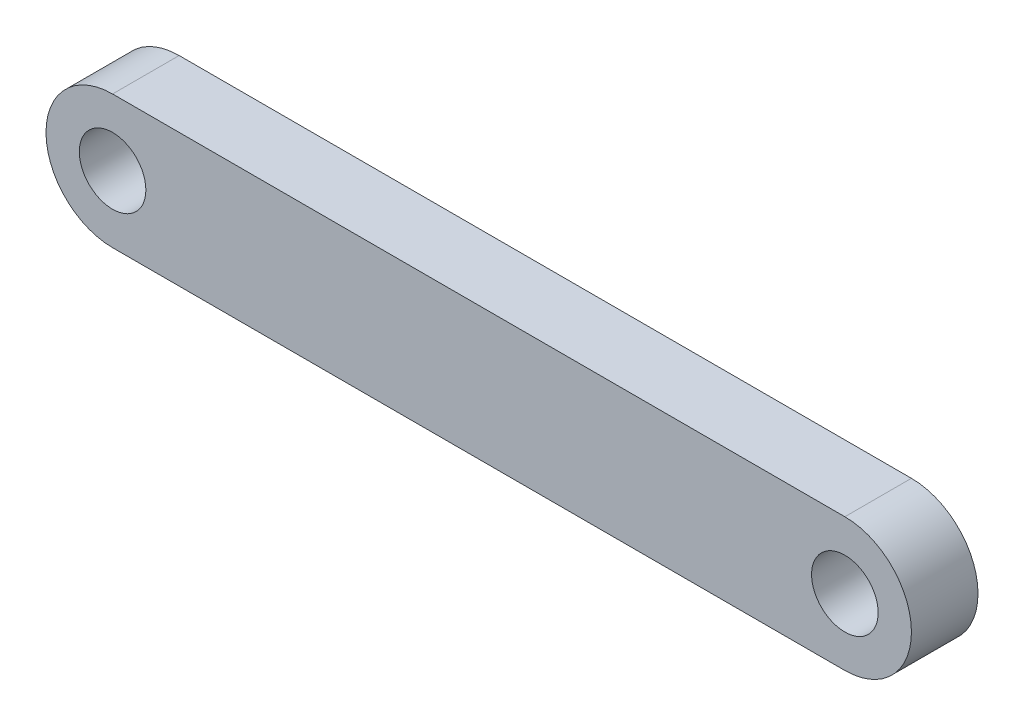
from build123d import *

# Parameters (mm, degrees)
SKETCH_1_R      = 1.5
EXTRUDE_1_DEPTH = 3


with BuildPart() as part:
    # 草图1 → 凸台-拉伸1 (new body)
    with BuildSketch(Plane.XY):
        with BuildLine():
            Line((0, 3), (33, 3))
            ThreePointArc((33, 3), (36, 0), (33, -3))
            Line((33, -3), (0, -3))
            ThreePointArc((0, -3), (-3, 0), (0, 3))
        make_face()
        Circle(SKETCH_1_R, mode=Mode.SUBTRACT)
        with Locations((33, 0)):
            Circle(SKETCH_1_R, mode=Mode.SUBTRACT)
    extrude(amount=EXTRUDE_1_DEPTH)


solid = part.part
